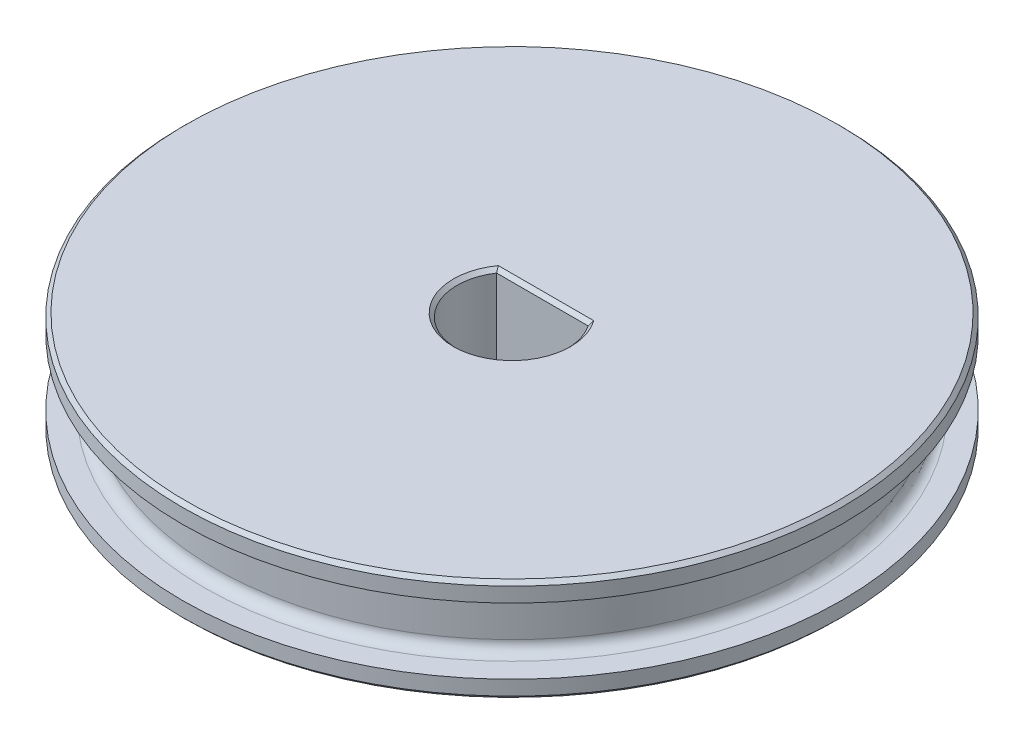
from build123d import *

# Parameters (mm, degrees)
CUT_EXTRUDE_2_DEPTH = 27.064535292
FILLET_1_R          = 0.6
CHAMFER_1_SIZE      = 0.2
CHAMFER_2_SIZE      = 0.2


with BuildPart() as part:
    # 草图1 → 旋转2 (revolve)
    with BuildSketch(Plane(origin=(0, 0, 0), x_dir=(0, 0, -1), z_dir=(1, 0, 0)), mode=Mode.PRIVATE) as revolve_2_sk:
        Polygon((-16.2, 1), (-18, 1), (-18, 0), (0, 0), (0, 5.6), (-18, 5.6), (-18, 4.6), (-16.2, 4.6), align=None)
    revolve(revolve_2_sk.sketch.rotate(Axis((0, 0, 0), (0, 1, 0)), 180), axis=Axis((0, 0, 0), (0, 1, 0)))

    # 草图2 → 切除-拉伸2 (cut, through all)
    with BuildSketch(Plane(origin=(0, 5.6, 0), x_dir=(1, 0, 0), z_dir=(0, 1, 0))):
        with BuildLine():
            Line((2.5, 1.658312395), (-2.5, 1.658312395))
            ThreePointArc((-2.5, 1.658312395), (-0.866025404, -2.872281323), (3, 0))
            ThreePointArc((3, 0), (2.872281323, 0.866025404), (2.5, 1.658312395))
        make_face()
    extrude(amount=-CUT_EXTRUDE_2_DEPTH, mode=Mode.SUBTRACT)

    # 圆角1
    fillet_1_edges = [part.edges().sort_by_distance(p)[0] for p in [
        (0, 1, 16.2),
        (0, 4.6, 16.2),
    ]]
    fillet(fillet_1_edges, radius=FILLET_1_R)

    # 倒角1
    chamfer_1_edges = [part.edges().sort_by_distance(p)[0] for p in [
        (0, 5.6, -1.658312395),
        (0, 0, 3),
        (0, 0, -1.658312395),
        (0, 5.6, 3),
    ]]
    chamfer(chamfer_1_edges, length=CHAMFER_1_SIZE)

    # 倒角2
    chamfer_2_edges = [part.edges().sort_by_distance(p)[0] for p in [
        (0, 0, 18),
        (0, 5.6, 18),
    ]]
    chamfer(chamfer_2_edges, length=CHAMFER_2_SIZE)


solid = part.part
